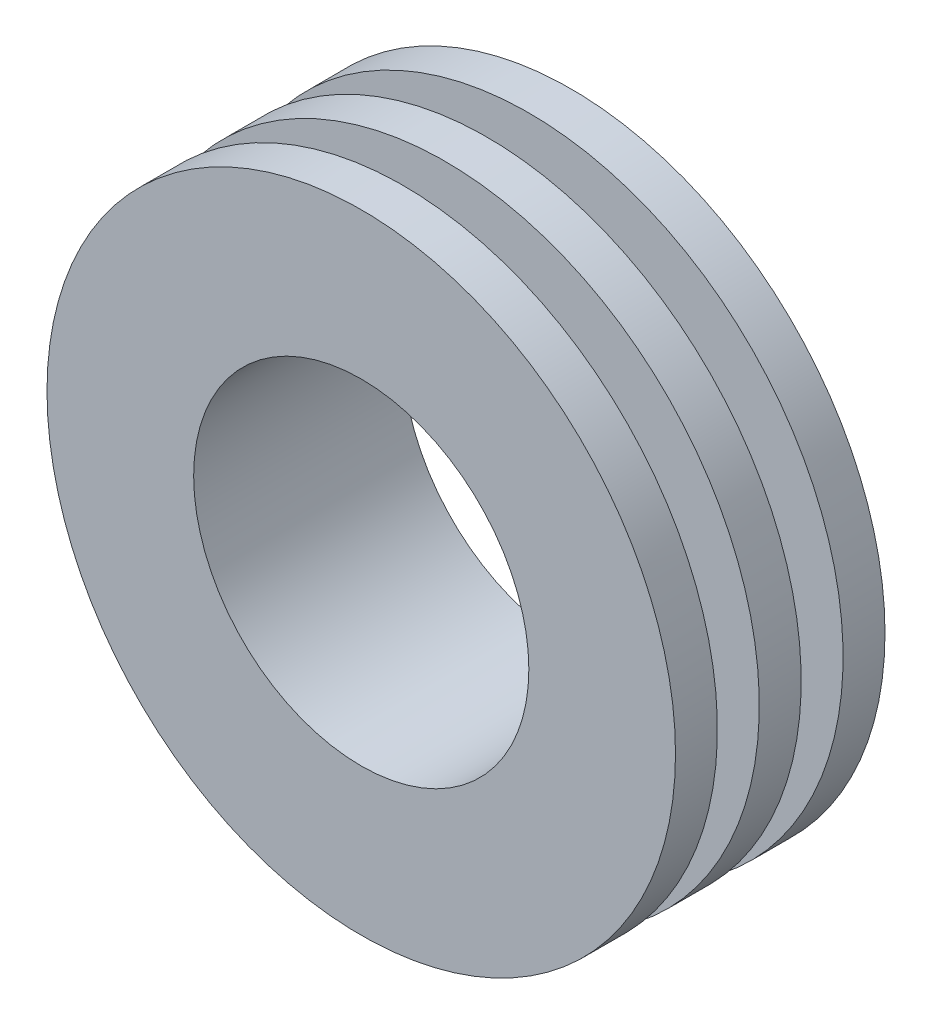
from build123d import *

# Parameters (mm, degrees)
SKETCH_1_R      = 7.5
SKETCH_1_R_2    = 4
EXTRUDE_1_DEPTH = 5
SKETCH_2_W      = 1
SKETCH_2_H      = 1.5


with BuildPart() as part:
    # 草图1 → 凸台-拉伸1 (new body)
    with BuildSketch(Plane.XY):
        Circle(SKETCH_1_R)
        Circle(SKETCH_1_R_2, mode=Mode.SUBTRACT)
    extrude(amount=EXTRUDE_1_DEPTH)

    # 草图2 → 切除-旋转1 (revolve, cut)
    with BuildSketch(Plane(origin=(0, 0, 0), x_dir=(0, 0, -1), z_dir=(1, 0, 0)), mode=Mode.PRIVATE) as cut_revolve_1_sk:
        with Locations((-3.5, 6.75)):
            Rectangle(SKETCH_2_W, SKETCH_2_H)
        with Locations((-1.5, 6.75)):
            Rectangle(SKETCH_2_W, SKETCH_2_H)
    revolve(cut_revolve_1_sk.sketch.rotate(Axis((0, 0, 0), (0, 0, 1)), 90), axis=Axis((0, 0, 0), (0, 0, 1)), mode=Mode.SUBTRACT)


solid = part.part
